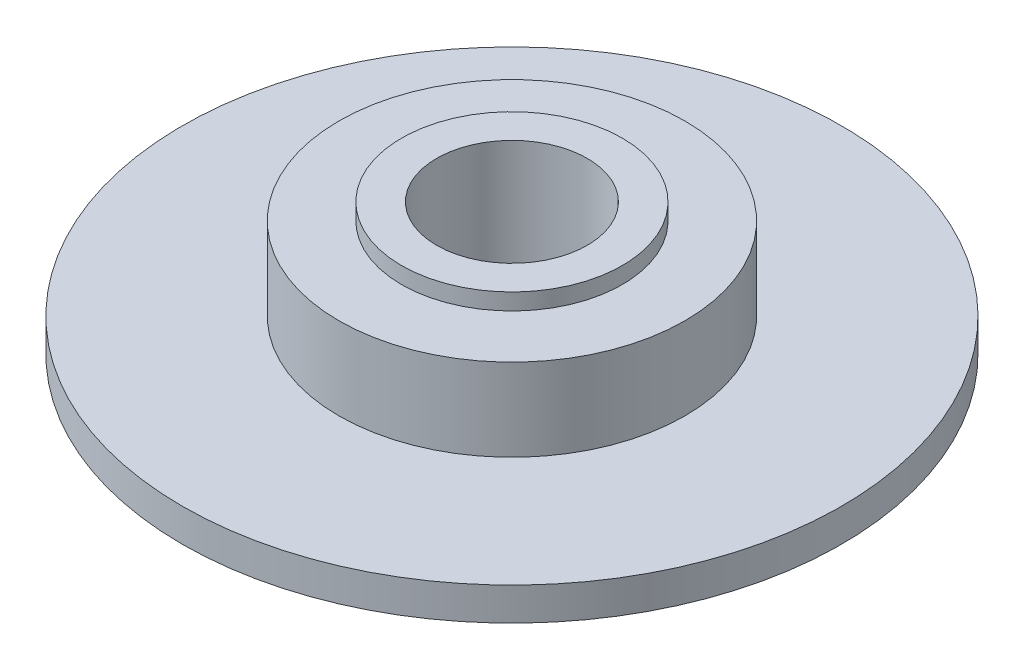
from build123d import *

# Parameters (mm, degrees)
SKETCH1_R           = 20
SKETCH1_R_2         = 4.572
BOSS_EXTRUDE1_DEPTH = 2
SKETCH2_R           = 10.5
SKETCH2_R_2         = 4.572
BOSS_EXTRUDE2_DEPTH = 5
SKETCH3_R           = 6.7
SKETCH3_R_2         = 4.572
BOSS_EXTRUDE3_DEPTH = 1


with BuildPart() as part:
    # Sketch1 → Boss-Extrude1 (new body)
    with BuildSketch(Plane(origin=(0, 0, 0), x_dir=(1, 0, 0), z_dir=(0, 1, 0))):
        with Locations(Location((0, 0, 0), (0, 0, 270))):
            Circle(SKETCH1_R)
        with Locations(Location((0, 0, 0), (0, 0, 270))):
            Circle(SKETCH1_R_2, mode=Mode.SUBTRACT)
    extrude(amount=BOSS_EXTRUDE1_DEPTH)

    # Sketch2 → Boss-Extrude2 (add)
    with BuildSketch(Plane(origin=(0, 2, 0), x_dir=(1, 0, 0), z_dir=(0, 1, 0))):
        with Locations(Location((0, 0, 0), (0, 0, 270))):
            Circle(SKETCH2_R)
        with Locations(Location((0, 0, 0), (0, 0, 270))):
            Circle(SKETCH2_R_2, mode=Mode.SUBTRACT)
    extrude(amount=BOSS_EXTRUDE2_DEPTH)

    # Sketch3 → Boss-Extrude3 (add)
    with BuildSketch(Plane(origin=(0, 7, 0), x_dir=(1, 0, 0), z_dir=(0, 1, 0))):
        with Locations(Location((0, 0, 0), (0, 0, 270))):
            Circle(SKETCH3_R)
        with Locations(Location((0, 0, 0), (0, 0, 270))):
            Circle(SKETCH3_R_2, mode=Mode.SUBTRACT)
    extrude(amount=BOSS_EXTRUDE3_DEPTH)


solid = part.part
